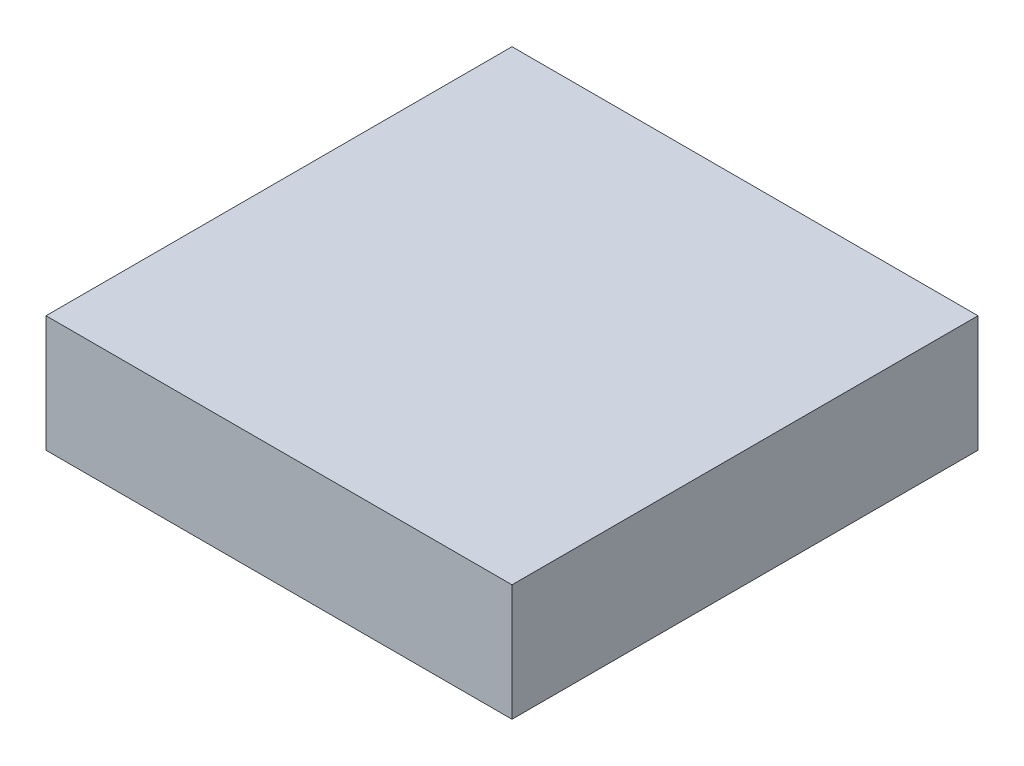
from build123d import *

# Parameters (mm, degrees)
SKETCH1_W           = 4
SKETCH1_H           = 4
BOSS_EXTRUDE1_DEPTH = 1


with BuildPart() as part:
    # Sketch1 → Boss-Extrude1 (new body)
    with BuildSketch(Plane(origin=(0, 0, 0), x_dir=(1, 0, 0), z_dir=(0, 1, 0))):
        with Locations((2, 2)):
            Rectangle(SKETCH1_W, SKETCH1_H)
    extrude(amount=BOSS_EXTRUDE1_DEPTH)


solid = part.part
